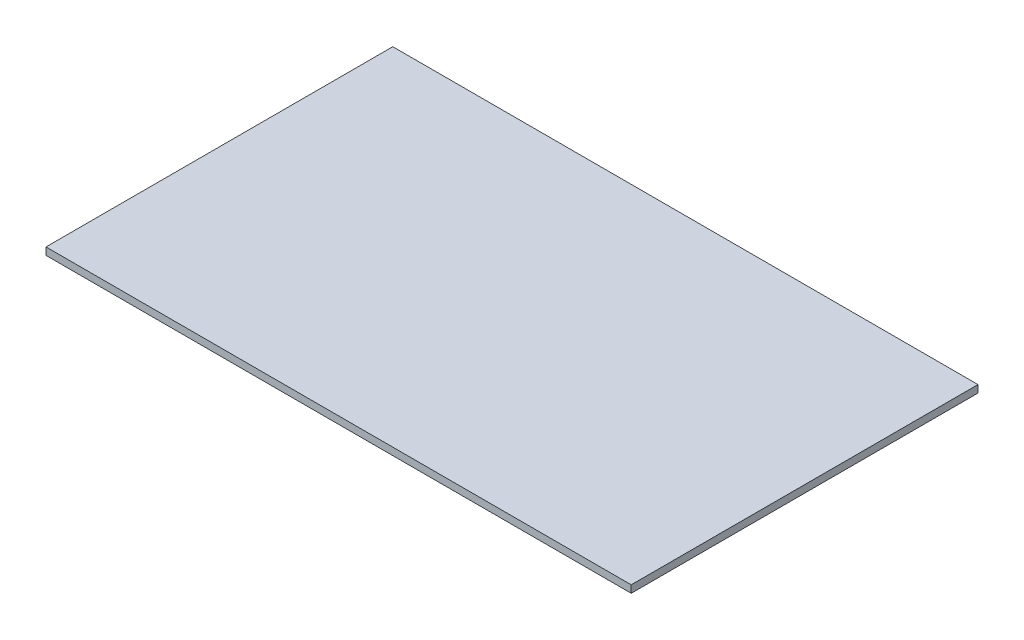
from build123d import *

# Parameters (mm, degrees)
CROQUIS1_W              = 135
CROQUIS1_H              = 80
SALIENTE_EXTRUIR1_DEPTH = 1.7


with BuildPart() as part:
    # Croquis1 → Saliente-Extruir1 (new body)
    with BuildSketch(Plane(origin=(0, 0, 0), x_dir=(1, 0, 0), z_dir=(0, 1, 0))):
        Rectangle(CROQUIS1_W, CROQUIS1_H)
    extrude(amount=SALIENTE_EXTRUIR1_DEPTH)


solid = part.part
